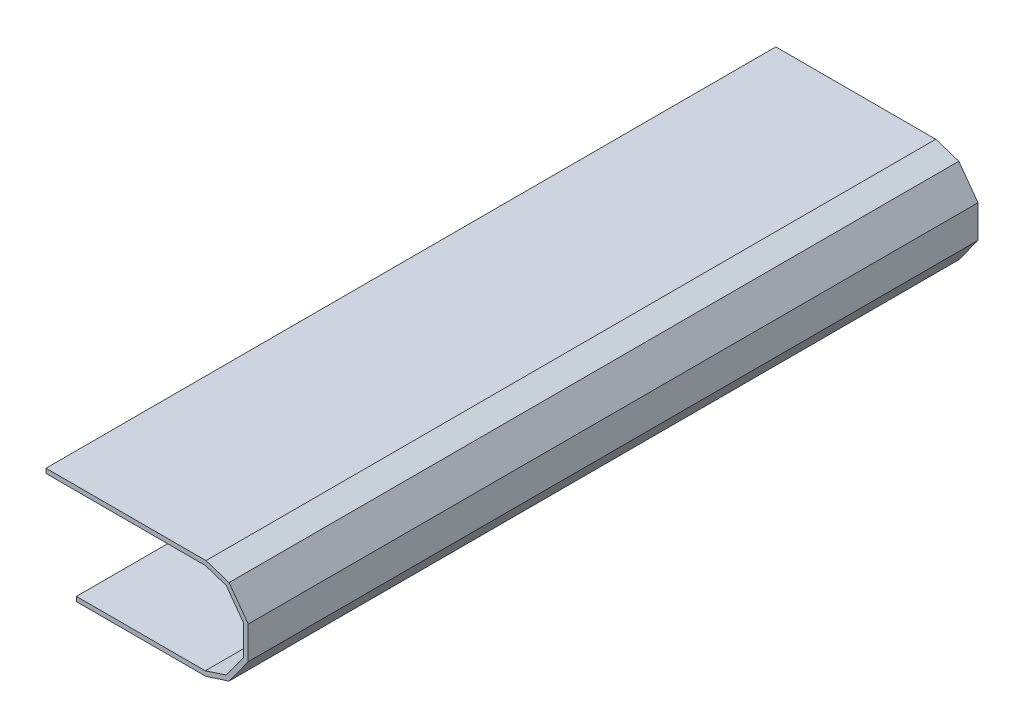
from build123d import *

# Parameters (mm, degrees)
BOSS_EXTRU_1_DEPTH = 480
ESQUISSE3_W        = 480
ESQUISSE3_H        = 3
BOSS_EXTRU_2_DEPTH = 20


with BuildPart() as part:
    # Esquisse1 → Boss.-Extru.1 (new body)
    with BuildSketch(Plane.XY):
        Polygon((0, 30), (-80, 30), (-80, 33), (0, 33), (5.226686531, 33), (20.395121629, 28.071476676), (33, 10.722349976), (33, -10.722349976), (20.395121629, -28.071476676), (5.226686531, -33), (0, -33), (-80, -33), (-80, -30), (0, -30), (4.75153321, -30), (18.541019662, -25.519524251), (30, -9.747590887), (30, 9.747590887), (18.541019662, 25.519524251), (4.75153321, 30), align=None)
    extrude(amount=BOSS_EXTRU_1_DEPTH)

    # Esquisse3 → Boss.-Extru.2 (add)
    with BuildSketch(Plane.ZY.offset(80)):
        with Locations((240, 31.5)):
            Rectangle(ESQUISSE3_W, ESQUISSE3_H)
    extrude(amount=BOSS_EXTRU_2_DEPTH)


solid = part.part
